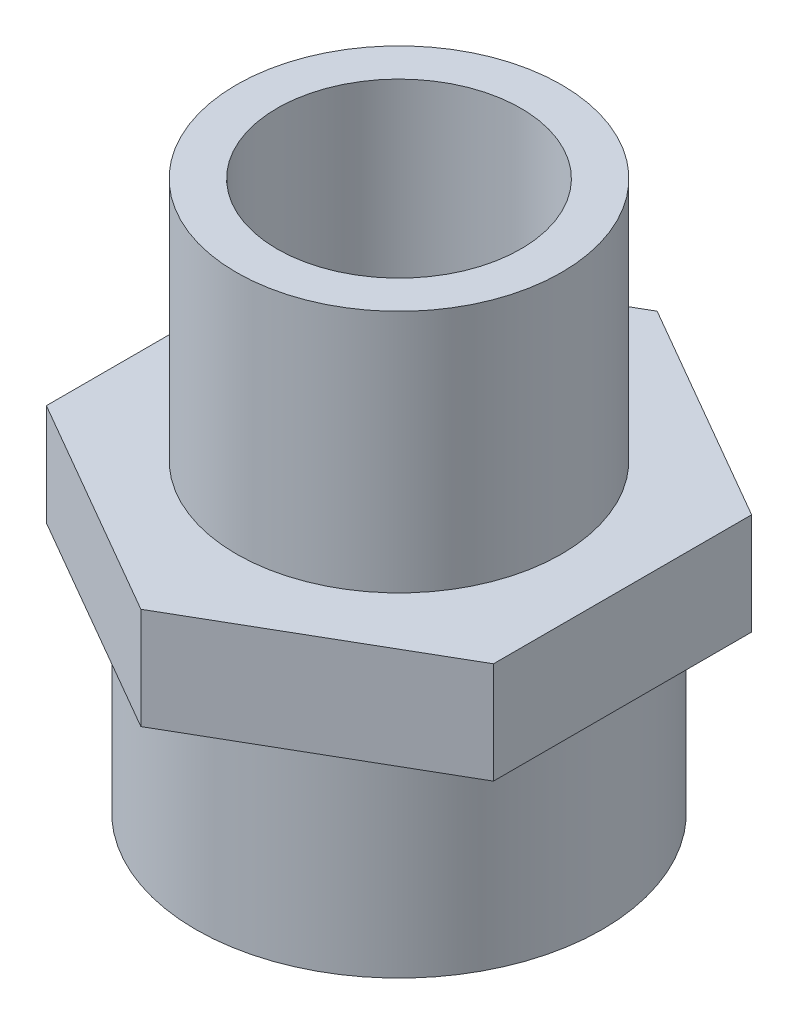
from build123d import *

# Parameters (mm, degrees)
SKETCH1_R           = 10.16
BOSS_EXTRUDE1_DEPTH = 15.24
BOSS_EXTRUDE2_DEPTH = 6.35
SKETCH3_R           = 12.7
BOSS_EXTRUDE3_DEPTH = 12.7
SKETCH4_R           = 7.62
CUT_EXTRUDE1_DEPTH  = 41.387863689


with BuildPart() as part:
    # Sketch1 → Boss-Extrude1 (new body)
    with BuildSketch(Plane(origin=(0, 0, 0), x_dir=(1, 0, 0), z_dir=(0, 1, 0))):
        with Locations(Location((0, 0, 0), (0, 0, 90))):
            Circle(SKETCH1_R)
    extrude(amount=BOSS_EXTRUDE1_DEPTH)

    # Sketch2 → Boss-Extrude2 (add)
    with BuildSketch(Plane.XZ):
        Polygon((-13.97, -8.065583261), (0, -16.131166521), (13.97, -8.065583261), (13.97, 8.065583261), (0, 16.131166521), (-13.97, 8.065583261), align=None)
    extrude(amount=BOSS_EXTRUDE2_DEPTH)

    # Sketch3 → Boss-Extrude3 (add)
    with BuildSketch(Plane.XZ.offset(6.35)):
        with Locations(Location((0, 0, 0), (0, 0, 270))):
            Circle(SKETCH3_R)
    extrude(amount=BOSS_EXTRUDE3_DEPTH)

    # Sketch4 → Cut-Extrude1 (cut, through all)
    with BuildSketch(Plane(origin=(0, 15.24, 0), x_dir=(1, 0, 0), z_dir=(0, 1, 0))):
        with Locations(Location((0, 0, 0), (0, 0, 270))):
            Circle(SKETCH4_R)
    extrude(amount=-CUT_EXTRUDE1_DEPTH, mode=Mode.SUBTRACT)


solid = part.part
